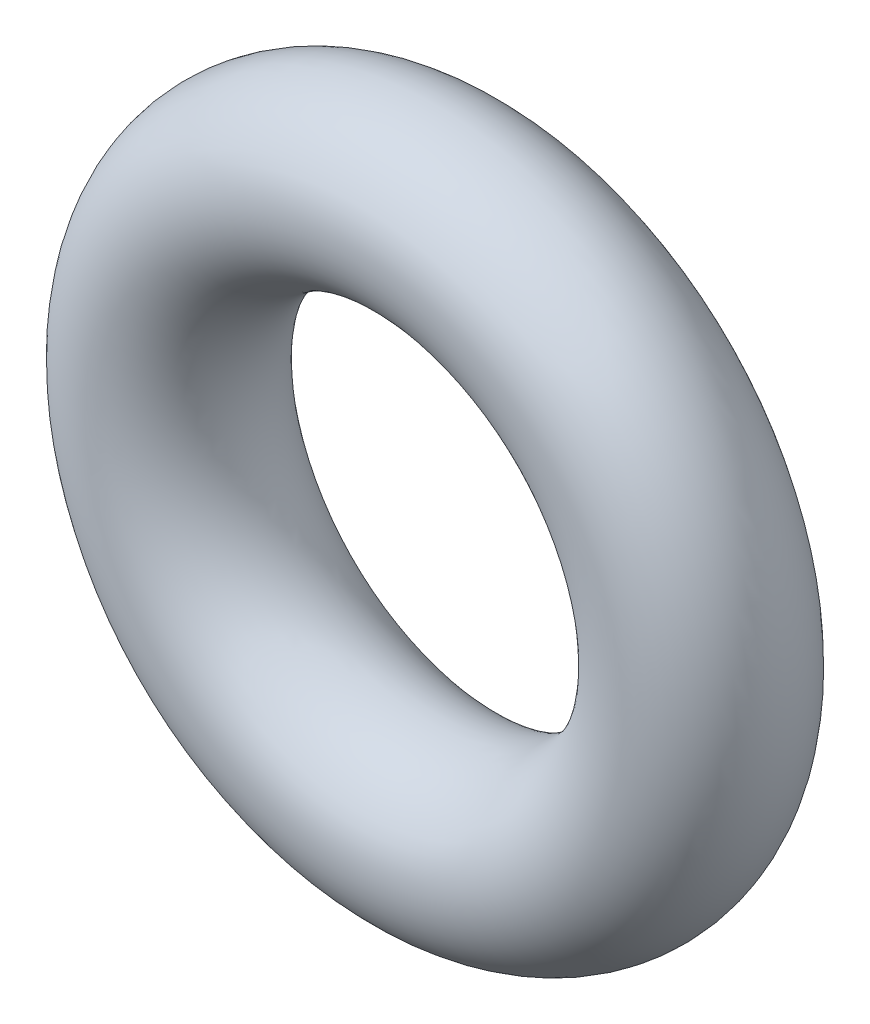
from build123d import *

# Parameters (mm, degrees)
SKETCH2_R = 0.889


with BuildPart() as part:
    # Sketch2 → Revolve1 (revolve)
    with BuildSketch(Plane(origin=(0, 0, 0), x_dir=(1, 0, 0), z_dir=(0, 1, 0)), mode=Mode.PRIVATE) as revolve1_sk:
        with Locations((-2.7305, 0)):
            Circle(SKETCH2_R)
    revolve(revolve1_sk.sketch.rotate(Axis((0, 0, 0.889), (0, 0, -1)), 180), axis=Axis((0, 0, 0.889), (0, 0, -1)))


solid = part.part
